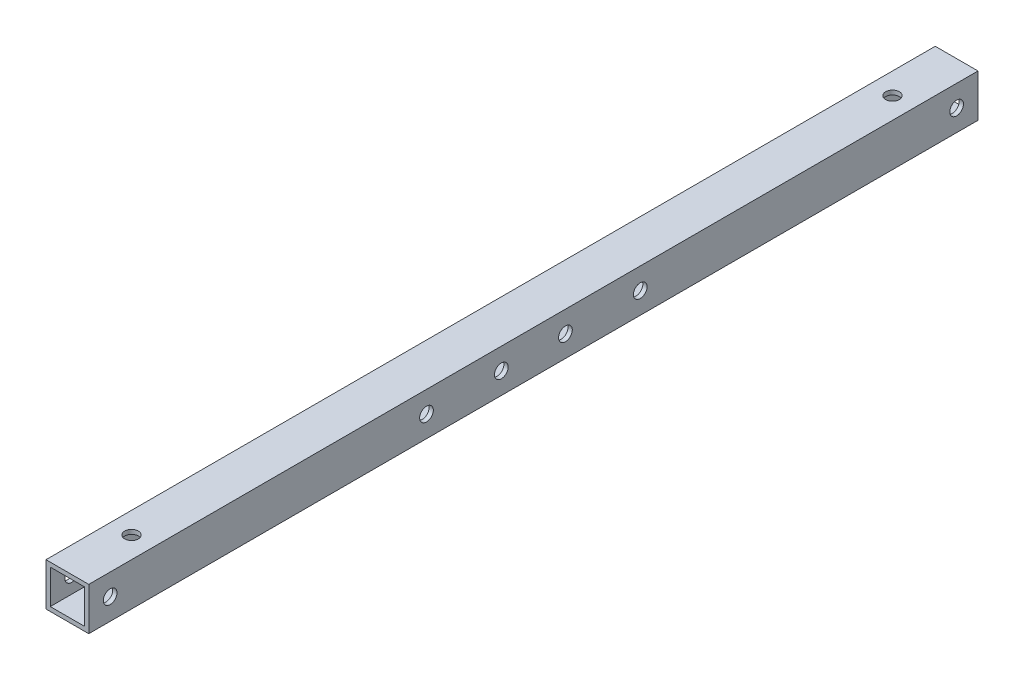
from build123d import *

# Parameters (mm, degrees)
SKETCH_1_W          = 10
SKETCH_1_H          = 10
SKETCH_1_W_2        = 8
SKETCH_1_H_2        = 8
EXTRUDE_1_DEPTH     = 208
SKETCH_2_R          = 1.6
CUT_EXTRUDE_1_DEPTH = 209.300264042
SKETCH_3_R          = 1.6
CUT_EXTRUDE_2_DEPTH = 209.300264042
SKETCH_4_R          = 1.6
CUT_EXTRUDE_3_DEPTH = 209.300264042


with BuildPart() as part:
    # ｽｹｯﾁ1 → ﾎﾞｽ - 押し出し1 (new body)
    with BuildSketch(Plane.XY):
        Rectangle(SKETCH_1_W, SKETCH_1_H)
        Rectangle(SKETCH_1_W_2, SKETCH_1_H_2, mode=Mode.SUBTRACT)
    extrude(amount=EXTRUDE_1_DEPTH)

    # ｽｹｯﾁ2 → ｶｯﾄ - 押し出し1 (cut, through all)
    with BuildSketch(Plane(origin=(5, 0, 0), x_dir=(0, 0, -1), z_dir=(1, 0, 0))):
        with Locations(Location((-203, 0, 0), (0, 0, 90))):
            Circle(SKETCH_2_R)
        with Locations(Location((-111.5, 0, 0), (0, 0, 90))):
            Circle(SKETCH_2_R)
        with Locations(Location((-96.5, 0, 0), (0, 0, 90))):
            Circle(SKETCH_2_R)
        with Locations(Location((-5, 0, 0), (0, 0, 90))):
            Circle(SKETCH_2_R)
    extrude(amount=-CUT_EXTRUDE_1_DEPTH, mode=Mode.SUBTRACT)

    # ｽｹｯﾁ3 → ｶｯﾄ - 押し出し2 (cut, through all)
    with BuildSketch(Plane(origin=(0, 5, 0), x_dir=(1, 0, 0), z_dir=(0, 1, 0))):
        with Locations(Location((0, -193, 0), (0, 0, 270))):
            Circle(SKETCH_3_R)
        with Locations(Location((0, -15, 0), (0, 0, 270))):
            Circle(SKETCH_3_R)
    extrude(amount=-CUT_EXTRUDE_2_DEPTH, mode=Mode.SUBTRACT)

    # ｽｹｯﾁ4 → ｶｯﾄ - 押し出し3 (cut, through all)
    with BuildSketch(Plane(origin=(5, 0, 0), x_dir=(0, 0, -1), z_dir=(1, 0, 0))):
        with Locations(Location((-129, 0, 0), (0, 0, 90))):
            Circle(SKETCH_4_R)
        with Locations(Location((-79, 0, 0), (0, 0, 90))):
            Circle(SKETCH_4_R)
    extrude(amount=-CUT_EXTRUDE_3_DEPTH, mode=Mode.SUBTRACT)


solid = part.part
